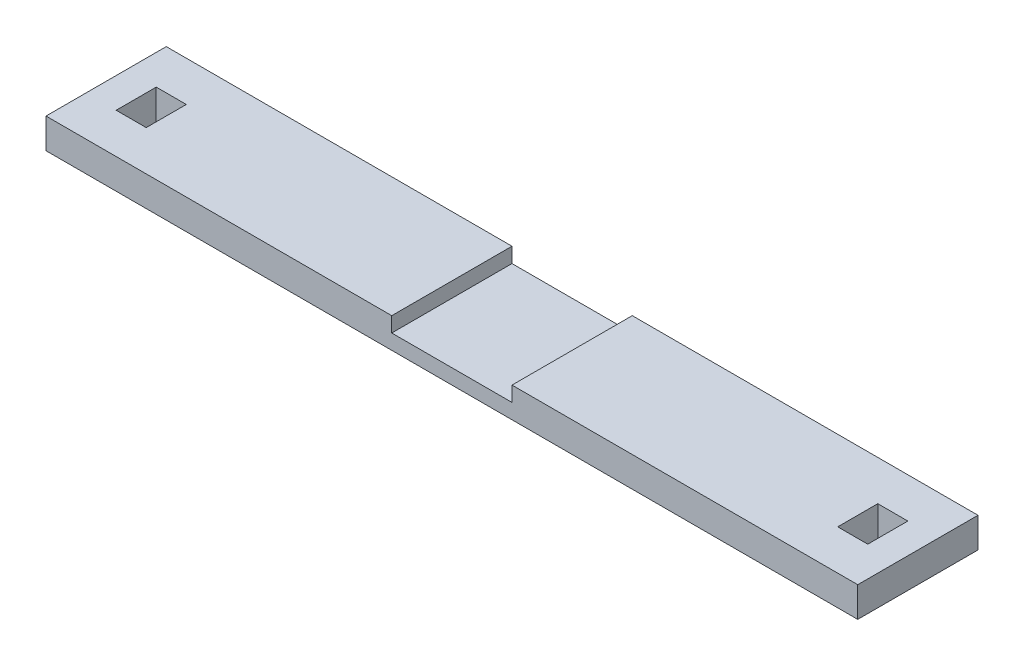
from build123d import *

# Parameters (mm, degrees)
SKETCH2_W           = 171.45
SKETCH2_H           = 25.4
BOSS_EXTRUDE1_DEPTH = 6.35
SKETCH3_W           = 6.35
SKETCH3_H           = 8.466666666
CUT_EXTRUDE1_DEPTH  = 174.437553604
SKETCH4_W           = 25.4
SKETCH4_H           = 25.4
CUT_EXTRUDE2_DEPTH  = 3.175


with BuildPart() as part:
    # Sketch2 → Boss-Extrude1 (new body)
    with BuildSketch(Plane(origin=(0, 0, 0), x_dir=(1, 0, 0), z_dir=(0, 1, 0))):
        with Locations((85.725, -12.7)):
            Rectangle(SKETCH2_W, SKETCH2_H)
    extrude(amount=BOSS_EXTRUDE1_DEPTH)

    # Sketch3 → Cut-Extrude1 (cut, through all)
    with BuildSketch(Plane(origin=(0, 6.35, 0), x_dir=(1, 0, 0), z_dir=(0, 1, 0))):
        with Locations((161.925, -12.7)):
            Rectangle(SKETCH3_W, SKETCH3_H)
        with Locations((9.525, -12.7)):
            Rectangle(SKETCH3_W, SKETCH3_H)
    extrude(amount=-CUT_EXTRUDE1_DEPTH, mode=Mode.SUBTRACT)

    # Sketch4 → Cut-Extrude2 (cut)
    with BuildSketch(Plane(origin=(0, 6.35, 0), x_dir=(1, 0, 0), z_dir=(0, 1, 0))):
        with Locations((85.725, -12.7)):
            Rectangle(SKETCH4_W, SKETCH4_H)
    extrude(amount=-CUT_EXTRUDE2_DEPTH, mode=Mode.SUBTRACT)


solid = part.part
